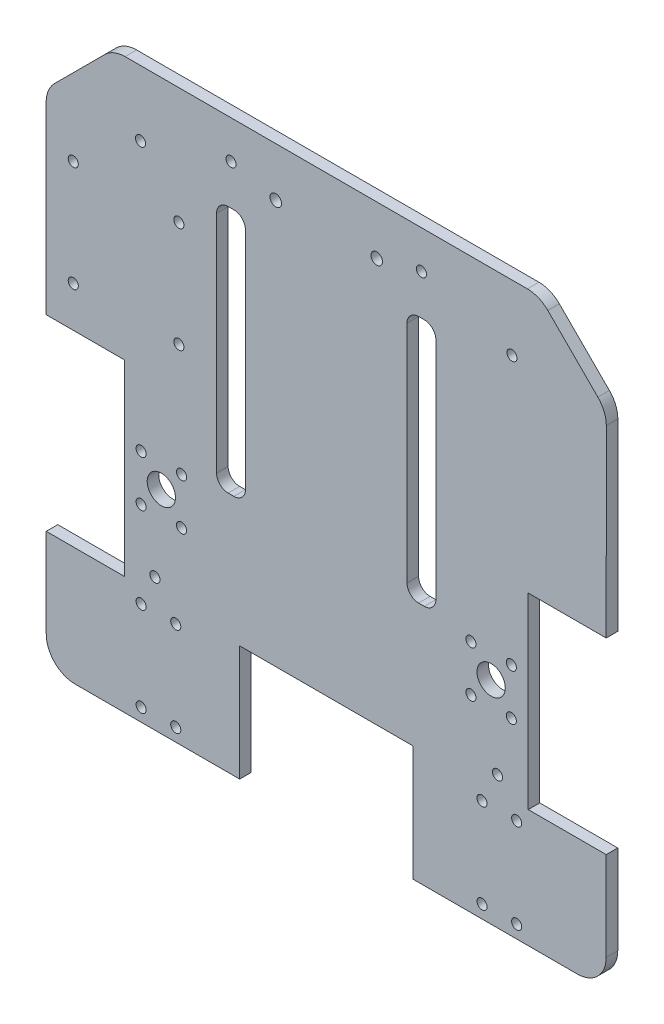
from build123d import *

# Parameters (mm, degrees)
EXTRUDE_1_DEPTH      = 4
L298N_R              = 1.75
CUT_EXTRUDE_5_DEPTH  = 10
SKETCH_628_R         = 1.75
CUT_EXTRUDE_7_DEPTH  = 10
SKETCH_1431_W        = 40
SKETCH_1431_H        = 65
CUT_EXTRUDE_8_DEPTH  = 10
SKETCH_4220_R        = 2
CUT_EXTRUDE_10_DEPTH = 10
SKETCH_2254_R        = 1.75
SKETCH_2254_R_2      = 4.9
CUT_EXTRUDE_3_DEPTH  = 10
CUT_EXTRUDE_11_REACH = 358.759
SKETCH_11_R          = 1.75
SKETCH_12_W          = 60
SKETCH_12_H          = 40
SKETCH_12_H_2        = 10
CUT_EXTRUDE_12_DEPTH = 10
SKETCH_13_R          = 1.75
CUT_EXTRUDE_14_DEPTH = 357.758930871
SKETCH_14_R          = 1.75
CUT_EXTRUDE_15_DEPTH = 10
CUT_EXTRUDE_16_DEPTH = 10
CUT_EXTRUDE_17_DEPTH = 10


with BuildPart() as part:
    # 草图3 → 凸台-拉伸1 (new body)
    with BuildSketch(Plane.XY):
        with BuildLine():
            Line((73.505746565, 259.089488009), (196.937204075, 259.089488009))
            ThreePointArc((196.937204075, 259.089488009), (204.590872722, 257.56707866), (211.079339699, 253.231623633))
            Line((211.079339699, 253.231623633), (239.363610946, 224.947352386))
            ThreePointArc((239.363610946, 224.947352386), (243.699065973, 218.458885409), (245.221475323, 210.805216762))
            Line((245.221475323, 210.805216762), (245.221475323, 54.089488009))
            ThreePointArc((245.221475323, 54.089488009), (239.363610946, 39.947352386), (225.221475323, 34.089488009))
            Line((225.221475323, 34.089488009), (45.221475318, 34.089488009))
            ThreePointArc((45.221475318, 34.089488009), (31.079339694, 39.947352386), (25.221475318, 54.089488009))
            Line((25.221475318, 54.089488009), (25.221475318, 210.805216762))
            ThreePointArc((25.221475318, 210.805216762), (26.743884667, 218.458885409), (31.079339694, 224.947352386))
            Line((31.079339694, 224.947352386), (59.363610941, 253.231623633))
            ThreePointArc((59.363610941, 253.231623633), (65.852077918, 257.56707866), (73.505746565, 259.089488009))
        make_face()
    extrude(amount=EXTRUDE_1_DEPTH)

    # L298N → 切除-拉伸5 (cut)
    with BuildSketch(Plane.XY):
        with Locations((47.555746565, 164.055216762)):
            Circle(L298N_R)
        with Locations((47.555746565, 200.655216762)):
            Circle(L298N_R)
        with Locations((84.155746565, 200.655216762)):
            Circle(L298N_R)
        with Locations((84.155746565, 164.055216762)):
            Circle(L298N_R)
    extrude(amount=CUT_EXTRUDE_5_DEPTH, mode=Mode.SUBTRACT)

    # Sketch 628 → 切除-拉伸7 (cut)
    with BuildSketch(Plane.XY):
        with Locations((168.22147532, 227.947352386)):
            Circle(SKETCH_628_R)
        with Locations(Location((168.22147532, 151.947352386, 0), (0, 0, 180))):
            Circle(SKETCH_628_R)
        with Locations((102.22147532, 151.947352386)):
            Circle(SKETCH_628_R)
        with Locations(Location((102.22147532, 227.947352386, 0), (0, 0, 180))):
            Circle(SKETCH_628_R)
    extrude(amount=CUT_EXTRUDE_7_DEPTH, mode=Mode.SUBTRACT)

    # Sketch 1431 → 切除-拉伸8 (cut)
    with BuildSketch(Plane.XY.offset(4)):
        with Locations((225.221475323, 117.447352386)):
            Rectangle(SKETCH_1431_W, SKETCH_1431_H)
        with Locations((45.221475318, 117.447352386)):
            Rectangle(SKETCH_1431_W, SKETCH_1431_H)
    extrude(amount=-CUT_EXTRUDE_8_DEPTH, mode=Mode.SUBTRACT)

    # Sketch 4220 → 切除-拉伸10 (cut)
    with BuildSketch(Plane.XY):
        with Locations((117.72147532, 224.089488009)):
            Circle(SKETCH_4220_R)
        with Locations((152.72147532, 224.089488009)):
            Circle(SKETCH_4220_R)
    extrude(amount=CUT_EXTRUDE_10_DEPTH, mode=Mode.SUBTRACT)

    # Sketch 2254 → 切除-拉伸3 (cut)
    with BuildSketch(Plane.XY):
        with Locations(Location((185.371475323, 109.447352386, 0), (0, 0, 180))):
            Circle(SKETCH_2254_R)
        with Locations((199.371475323, 125.447352386)):
            Circle(SKETCH_2254_R)
        with Locations((192.371475323, 117.447352386)):
            Circle(SKETCH_2254_R_2)
        with Locations((185.371475323, 125.447352386)):
            Circle(SKETCH_2254_R)
        with Locations(Location((199.371475323, 109.447352386, 0), (0, 0, 180))):
            Circle(SKETCH_2254_R)
        with Locations((71.071475318, 109.447352386)):
            Circle(SKETCH_2254_R)
        with Locations(Location((85.071475318, 125.447352386, 0), (0, 0, 180))):
            Circle(SKETCH_2254_R)
        with Locations(Location((78.071475318, 117.447352386, 0), (0, 0, 180))):
            Circle(SKETCH_2254_R_2)
        with Locations(Location((71.071475318, 125.447352386, 0), (0, 0, 180))):
            Circle(SKETCH_2254_R)
        with Locations((85.071475318, 109.447352386)):
            Circle(SKETCH_2254_R)
    extrude(amount=CUT_EXTRUDE_3_DEPTH, mode=Mode.SUBTRACT)

    # 草图11 → 切除-拉伸11 (cut, up to next)
    with BuildSketch(Plane.XY.offset(4), mode=Mode.PRIVATE) as cut_extrude_11_sk1:
        with Locations((75.852077918, 90.089488009)):
            Circle(SKETCH_11_R)
    cut_extrude_11_tool1 = extrude(cut_extrude_11_sk1.sketch, amount=-CUT_EXTRUDE_11_REACH, mode=Mode.PRIVATE) & part.part
    # 草图11 → 切除-拉伸11 (cut, up to next)
    with BuildSketch(Plane.XY.offset(4), mode=Mode.PRIVATE) as cut_extrude_11_sk2:
        with Locations((70.852077918, 218.458885409)):
            Circle(SKETCH_11_R)
    cut_extrude_11_tool2 = extrude(cut_extrude_11_sk2.sketch, amount=-CUT_EXTRUDE_11_REACH, mode=Mode.PRIVATE) & part.part
    # 草图11 → 切除-拉伸11 (cut, up to next)
    with BuildSketch(Plane.XY.offset(4), mode=Mode.PRIVATE) as cut_extrude_11_sk3:
        with Locations((199.590872722, 218.458885409)):
            Circle(SKETCH_11_R)
    cut_extrude_11_tool3 = extrude(cut_extrude_11_sk3.sketch, amount=-CUT_EXTRUDE_11_REACH, mode=Mode.PRIVATE) & part.part
    # 草图11 → 切除-拉伸11 (cut, up to next)
    with BuildSketch(Plane.XY.offset(4), mode=Mode.PRIVATE) as cut_extrude_11_sk4:
        with Locations((194.590872722, 90.089488009)):
            Circle(SKETCH_11_R)
    cut_extrude_11_tool4 = extrude(cut_extrude_11_sk4.sketch, amount=-CUT_EXTRUDE_11_REACH, mode=Mode.PRIVATE) & part.part
    add(cut_extrude_11_tool1.solids().sort_by_distance((75.852078, 90.089488, 4))[0], mode=Mode.SUBTRACT)
    add(cut_extrude_11_tool2.solids().sort_by_distance((70.852078, 218.458885, 4))[0], mode=Mode.SUBTRACT)
    add(cut_extrude_11_tool3.solids().sort_by_distance((199.590873, 218.458885, 4))[0], mode=Mode.SUBTRACT)
    add(cut_extrude_11_tool4.solids().sort_by_distance((194.590873, 90.089488, 4))[0], mode=Mode.SUBTRACT)

    # 草图12 → 切除-拉伸12 (cut)
    with BuildSketch(Plane.XY.offset(4)):
        with Locations((135.22147532, 54.089488009)):
            Rectangle(SKETCH_12_W, SKETCH_12_H)
        with Locations((135.22147532, 79.089488009)):
            Rectangle(SKETCH_12_W, SKETCH_12_H_2)
    extrude(amount=-CUT_EXTRUDE_12_DEPTH, mode=Mode.SUBTRACT)

    # 草图13 → 切除-拉伸14 (cut, through all)
    with BuildSketch(Plane.XY.offset(4)):
        with Locations((83.07147532, 48.589488009)):
            Circle(SKETCH_13_R)
        with Locations((71.07147532, 48.589488009)):
            Circle(SKETCH_13_R)
        with Locations(Location((71.07147532, 79.589488009, 0), (0, 0, 180))):
            Circle(SKETCH_13_R)
        with Locations(Location((83.07147532, 79.589488009, 0), (0, 0, 180))):
            Circle(SKETCH_13_R)
        with Locations((189.22147532, 79.589488009)):
            Circle(SKETCH_13_R)
        with Locations((201.22147532, 79.589488009)):
            Circle(SKETCH_13_R)
        with Locations(Location((201.22147532, 48.589488009, 0), (0, 0, 180))):
            Circle(SKETCH_13_R)
        with Locations(Location((189.22147532, 48.589488009, 0), (0, 0, 180))):
            Circle(SKETCH_13_R)
    extrude(amount=-CUT_EXTRUDE_14_DEPTH, mode=Mode.SUBTRACT)

    # 草图14 → 切除-拉伸15 (cut)
    with BuildSketch(Plane.XY.offset(4)):
        with BuildLine():
            Line((103.22147532, 213.947352386), (101.22147532, 213.947352386))
            ThreePointArc((101.22147532, 213.947352386), (98.393048195, 212.77577951), (97.22147532, 209.947352386))
            Line((97.22147532, 209.947352386), (97.22147532, 131.947352386))
            ThreePointArc((97.22147532, 131.947352386), (98.393048195, 129.118925261), (101.22147532, 127.947352386))
            Line((101.22147532, 127.947352386), (103.22147532, 127.947352386))
            ThreePointArc((103.22147532, 127.947352386), (106.049902445, 129.118925261), (107.22147532, 131.947352386))
            Line((107.22147532, 131.947352386), (107.22147532, 209.947352386))
            ThreePointArc((107.22147532, 209.947352386), (106.049902445, 212.77577951), (103.22147532, 213.947352386))
        make_face()
        with BuildLine():
            Line((167.22147532, 213.947352386), (169.22147532, 213.947352386))
            ThreePointArc((169.22147532, 213.947352386), (172.049902445, 212.77577951), (173.22147532, 209.947352386))
            Line((173.22147532, 209.947352386), (173.22147532, 131.947352386))
            ThreePointArc((173.22147532, 131.947352386), (172.049902445, 129.118925261), (169.22147532, 127.947352386))
            Line((169.22147532, 127.947352386), (167.22147532, 127.947352386))
            ThreePointArc((167.22147532, 127.947352386), (164.393048195, 129.118925261), (163.22147532, 131.947352386))
            Line((163.22147532, 131.947352386), (163.22147532, 209.947352386))
            ThreePointArc((163.22147532, 209.947352386), (164.393048195, 212.77577951), (167.22147532, 213.947352386))
        make_face()
        with Locations((102.22147532, 207.947352386)):
            Circle(SKETCH_14_R)
    extrude(amount=-CUT_EXTRUDE_15_DEPTH, mode=Mode.SUBTRACT)

    # 草图16 → 切除-拉伸16 (cut)
    with BuildSketch(Plane.XY):
        with BuildLine():
            Line((38.186724359, 149.947352386), (38.152623691, 213.731017405))
            ThreePointArc((38.152623691, 213.731017405), (38.912804296, 217.560728224), (41.08155445, 220.807431517))
            Line((41.08155445, 220.807431517), (58.434678753, 238.160555821))
            ThreePointArc((58.434678753, 238.160555821), (61.678912242, 240.328283334), (65.505746565, 241.089488009))
            Line((65.505746565, 241.089488009), (204.937204075, 241.089488009))
            ThreePointArc((204.937204075, 241.089488009), (208.764038399, 240.328283334), (212.008271887, 238.160555821))
            Line((212.008271887, 238.160555821), (229.361396191, 220.807431517))
            ThreePointArc((229.361396191, 220.807431517), (231.530146344, 217.560728224), (232.29032695, 213.731017405))
            Line((232.29032695, 213.731017405), (232.256226281, 149.947352386))
            Line((232.256226281, 149.947352386), (245.221475323, 149.947352386))
            Line((245.221475323, 149.947352386), (245.221475323, 210.805216762))
            ThreePointArc((245.221475323, 210.805216762), (243.699065973, 218.458885409), (239.363610946, 224.947352386))
            Line((239.363610946, 224.947352386), (211.079339699, 253.231623633))
            ThreePointArc((211.079339699, 253.231623633), (204.590872722, 257.56707866), (196.937204075, 259.089488009))
            Line((196.937204075, 259.089488009), (73.505746565, 259.089488009))
            ThreePointArc((73.505746565, 259.089488009), (65.852077918, 257.56707866), (59.363610941, 253.231623633))
            Line((59.363610941, 253.231623633), (31.079339694, 224.947352386))
            ThreePointArc((31.079339694, 224.947352386), (26.743884667, 218.458885409), (25.221475318, 210.805216762))
            Line((25.221475318, 210.805216762), (25.221475318, 149.947352386))
            Line((25.221475318, 149.947352386), (38.186724359, 149.947352386))
        make_face()
    extrude(amount=CUT_EXTRUDE_16_DEPTH, mode=Mode.SUBTRACT)

    # 草图18 → 切除-拉伸17 (cut)
    with BuildSketch(Plane.XY):
        with BuildLine():
            Line((48.186724359, 44.089488009), (95.22147532, 44.089488009))
            Line((95.22147532, 44.089488009), (105.22147532, 44.089488009))
            Line((105.22147532, 44.089488009), (105.22147532, 34.089488009))
            Line((105.22147532, 34.089488009), (45.221475318, 34.089488009))
            ThreePointArc((45.221475318, 34.089488009), (31.079339694, 39.947352386), (25.221475318, 54.089488009))
            Line((25.221475318, 54.089488009), (25.221475318, 84.947352386))
            Line((25.221475318, 84.947352386), (38.186724359, 84.947352386))
            Line((38.186724359, 84.947352386), (38.186724359, 54.089488009))
            ThreePointArc((38.186724359, 54.089488009), (41.115656548, 47.018420197), (48.186724359, 44.089488009))
        make_face()
        with BuildLine():
            Line((175.22147532, 44.089488009), (222.256226281, 44.089488009))
            ThreePointArc((222.256226281, 44.089488009), (229.327294093, 47.018420197), (232.256226281, 54.089488009))
            Line((232.256226281, 54.089488009), (232.256226281, 84.947352386))
            Line((232.256226281, 84.947352386), (245.221475323, 84.947352386))
            Line((245.221475323, 84.947352386), (245.221475323, 54.089488009))
            ThreePointArc((245.221475323, 54.089488009), (239.363610946, 39.947352386), (225.221475323, 34.089488009))
            Line((225.221475323, 34.089488009), (165.22147532, 34.089488009))
            Line((165.22147532, 34.089488009), (165.22147532, 44.089488009))
            Line((165.22147532, 44.089488009), (175.22147532, 44.089488009))
        make_face()
    extrude(amount=CUT_EXTRUDE_17_DEPTH, mode=Mode.SUBTRACT)


solid = part.part
